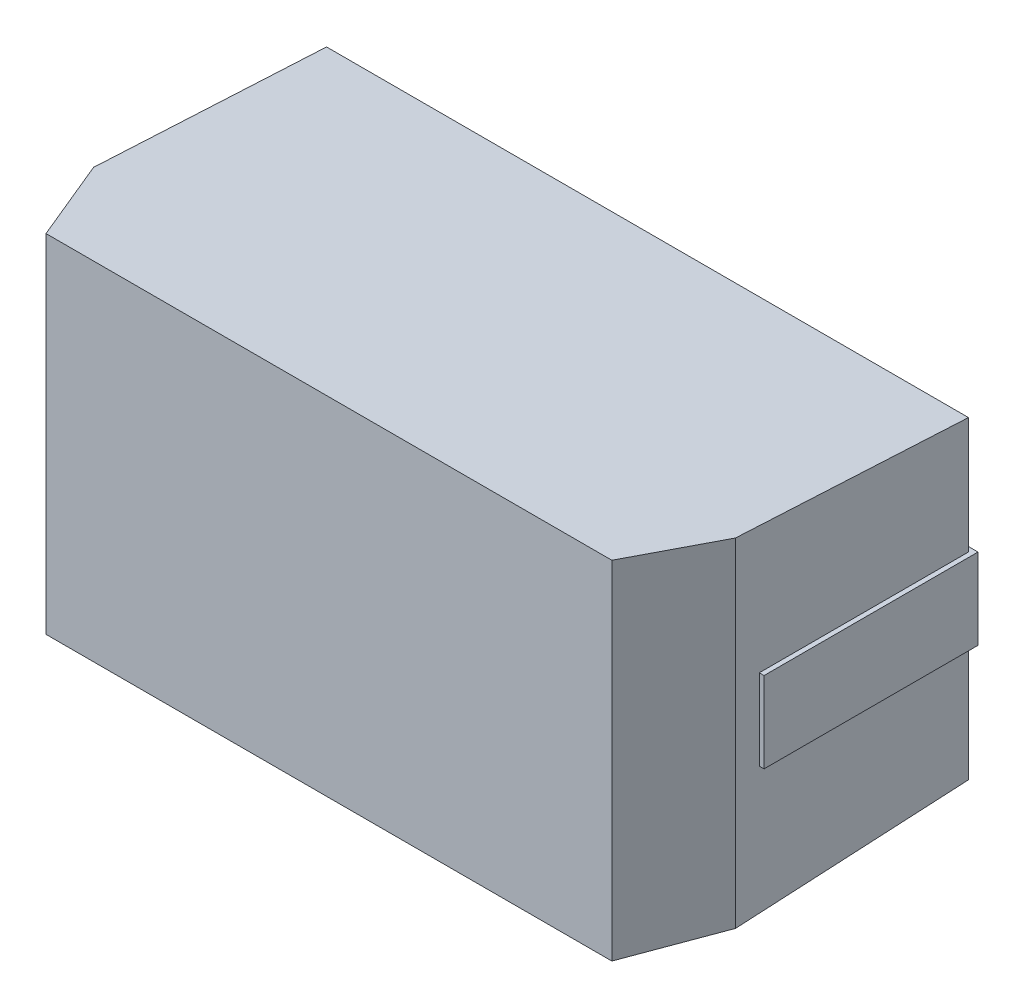
from build123d import *
from OCP.BRepFilletAPI import BRepFilletAPI_MakeChamfer

# Parameters (mm, degrees)
BOSS_EXTRUDE1_START = 0.1
SKETCH1_W           = 13.5
SKETCH1_H           = 7.3
BOSS_EXTRUDE1_DEPTH = 6.7
CHAMFER1_SIZE       = 1.8
CHAMFER1_SIZE2      = 0.8
BOSS_EXTRUDE2_DEPTH = 0.85
DRAFT1_ANGLE        = -3


with BuildPart() as part:
    # Sketch1 → Boss-Extrude1 (new body)
    with BuildSketch(Plane.XY.offset(BOSS_EXTRUDE1_START)):
        Rectangle(SKETCH1_W, SKETCH1_H)
    extrude(amount=BOSS_EXTRUDE1_DEPTH)

    # Chamfer1: one chamfer whose edges measure the first distance from different faces: ONE call of the kernel's chamfer builder (chamfer() names one face for all edges)
    chamfer1_edges_1 = [part.edges().sort_by_distance(p)[0] for p in [
        (6.75, 0, 6.8),
    ]]
    chamfer1_side_1 = [part.faces().sort_by_distance(p)[0] for p in [
        (6.75, 0, 3.45),
    ]]
    chamfer1_edges_2 = [part.edges().sort_by_distance(p)[0] for p in [
        (-6.75, 0, 6.8),
    ]]
    chamfer1_side_2 = [part.faces().sort_by_distance(p)[0] for p in [
        (-6.75, 0, 3.45),
    ]]
    chamfer1 = BRepFilletAPI_MakeChamfer(part.part.solid().wrapped)
    for e in chamfer1_edges_1:
        chamfer1.Add(CHAMFER1_SIZE, CHAMFER1_SIZE2, e.wrapped, chamfer1_side_1[0].wrapped)  # the first distance lies on this face
    for e in chamfer1_edges_2:
        chamfer1.Add(CHAMFER1_SIZE, CHAMFER1_SIZE2, e.wrapped, chamfer1_side_2[0].wrapped)  # the first distance lies on this face
    add(Compound.cast(chamfer1.Shape()), mode=Mode.REPLACE)

    # Sketch2 → Boss-Extrude2 (add, symmetric)
    with BuildSketch(Plane(origin=(0, 0, 0), x_dir=(1, 0, 0), z_dir=(0, 1, 0))):
        Polygon((4.35, -0.1), (6.75, -0.1), (6.75, -4.5), (6.85, -4.5), (6.85, 0), (4.35, 0), align=None)
    boss_extrude2 = extrude(amount=BOSS_EXTRUDE2_DEPTH, both=True)

    # Mirror1: Boss-Extrude2 across plane
    add(boss_extrude2.mirror(Plane(origin=(0, 0, 0), x_dir=(0, 0, 1), z_dir=(1, 0, 0))))

    # Draft1
    draft1_faces = [part.faces().sort_by_distance(p)[0] for p in [
        (0, 3.65, 3.405510617),
        (0, -3.65, 3.405510617),
    ]]
    draft(draft1_faces, Plane.XY.offset(6.8), DRAFT1_ANGLE)


solid = part.part
